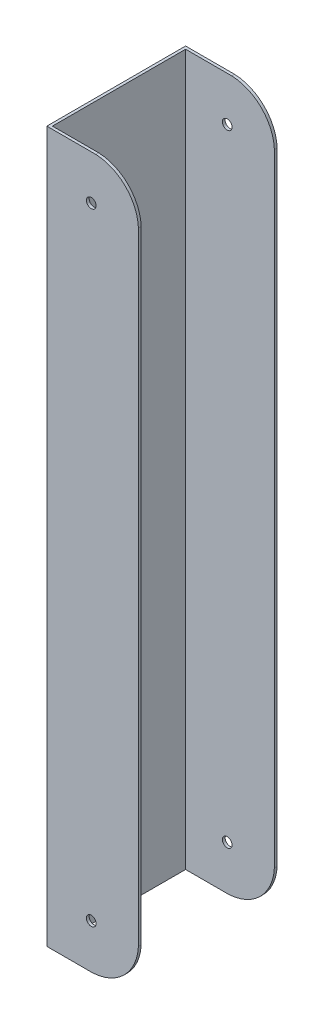
from build123d import *

# Parameters (mm, degrees)
BOSS_EXTRUDE1_DEPTH = 406.4
CUT_EXTRUDE1_DEPTH  = 406.4
SKETCH3_R           = 2.778125
CUT_EXTRUDE2_DEPTH  = 406.4


with BuildPart() as part:
    # Sketch1 → Boss-Extrude1 (new body)
    with BuildSketch(Plane(origin=(0, 0, 0), x_dir=(1, 0, 0), z_dir=(0, 1, 0))):
        Polygon((0, 0), (-52.3875, 0), (-52.3875, 79.375), (0, 79.375), (0, 77.7875), (-50.8, 77.7875), (-50.8, 1.5875), (0, 1.5875), align=None)
    extrude(amount=BOSS_EXTRUDE1_DEPTH)

    # Sketch2 → Cut-Extrude1 (cut)
    with BuildSketch(Plane.XY):
        with BuildLine():
            Line((0, 0), (0, 26.19375))
            ThreePointArc((0, 26.19375), (-8.070831371, 8.070831371), (-26.19375, 0))
            Line((-26.19375, 0), (0, 0))
        make_face()
        with BuildLine():
            Line((0, 382.011163771), (0, 406.4))
            Line((0, 406.4), (-24.388836229, 406.4))
            ThreePointArc((-24.388836229, 406.4), (-7.396266769, 399.003733231), (0, 382.011163771))
        make_face()
    extrude(amount=-CUT_EXTRUDE1_DEPTH, mode=Mode.SUBTRACT)

    # Sketch3 → Cut-Extrude2 (cut)
    with BuildSketch(Plane.XY):
        with Locations((-26.9875, 381)):
            Circle(SKETCH3_R)
        with Locations((-26.9875, 25.4)):
            Circle(SKETCH3_R)
    extrude(amount=-CUT_EXTRUDE2_DEPTH, mode=Mode.SUBTRACT)


solid = part.part
